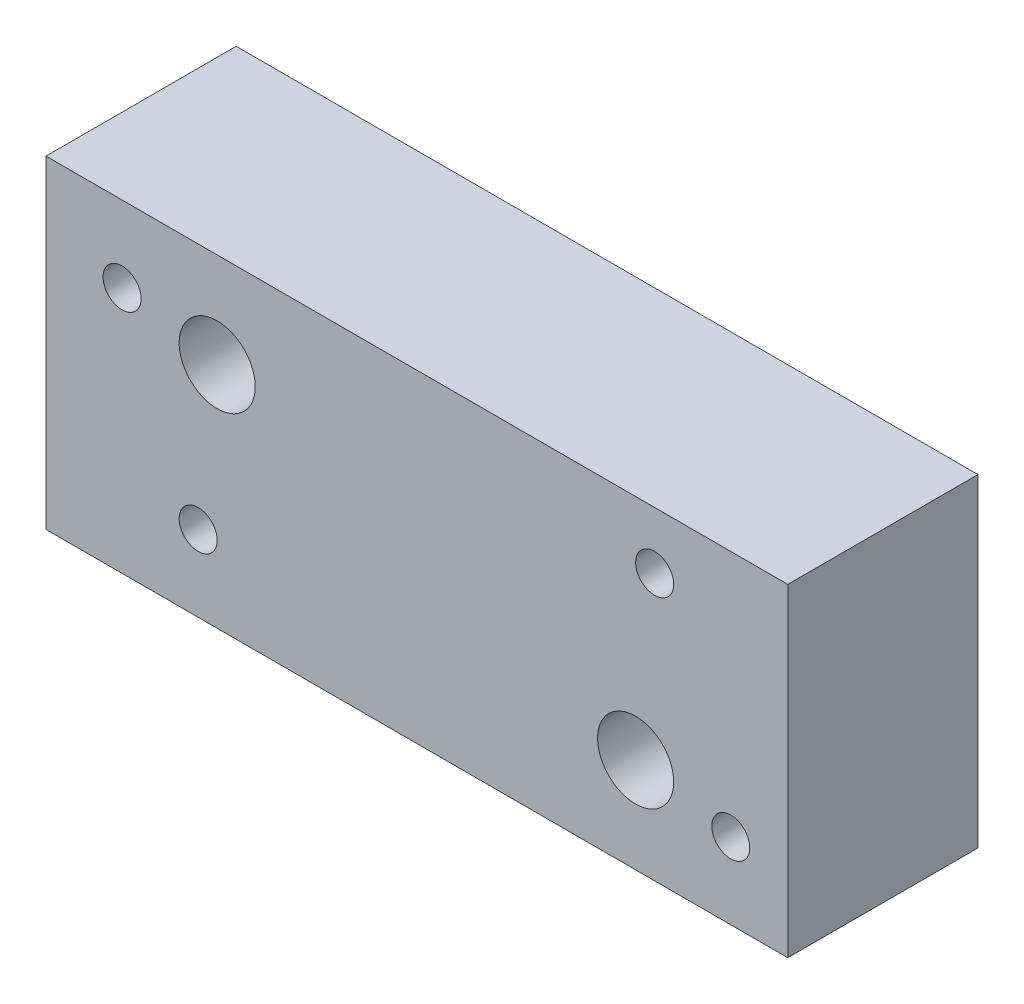
from build123d import *

# Parameters (mm, degrees)
SKETCH1_W           = 39
SKETCH1_H           = 17
SKETCH1_R           = 2
SKETCH1_R_2         = 1
BOSS_EXTRUDE1_DEPTH = 5


with BuildPart() as part:
    # Sketch1 → Boss-Extrude1 (new, symmetric)
    with BuildSketch(Plane.XY):
        Rectangle(SKETCH1_W, SKETCH1_H)
        with Locations((-10.5, 3.5)):
            Circle(SKETCH1_R, mode=Mode.SUBTRACT)
        with Locations((-15.5, 4.5)):
            Circle(SKETCH1_R_2, mode=Mode.SUBTRACT)
        with Locations((-11.5, -4.5)):
            Circle(SKETCH1_R_2, mode=Mode.SUBTRACT)
        with Locations((11.5, -3.5)):
            Circle(SKETCH1_R, mode=Mode.SUBTRACT)
        with Locations((12.5, 5.5)):
            Circle(SKETCH1_R_2, mode=Mode.SUBTRACT)
        with Locations((16.5, -4.5)):
            Circle(SKETCH1_R_2, mode=Mode.SUBTRACT)
    extrude(amount=BOSS_EXTRUDE1_DEPTH, both=True)


solid = part.part
